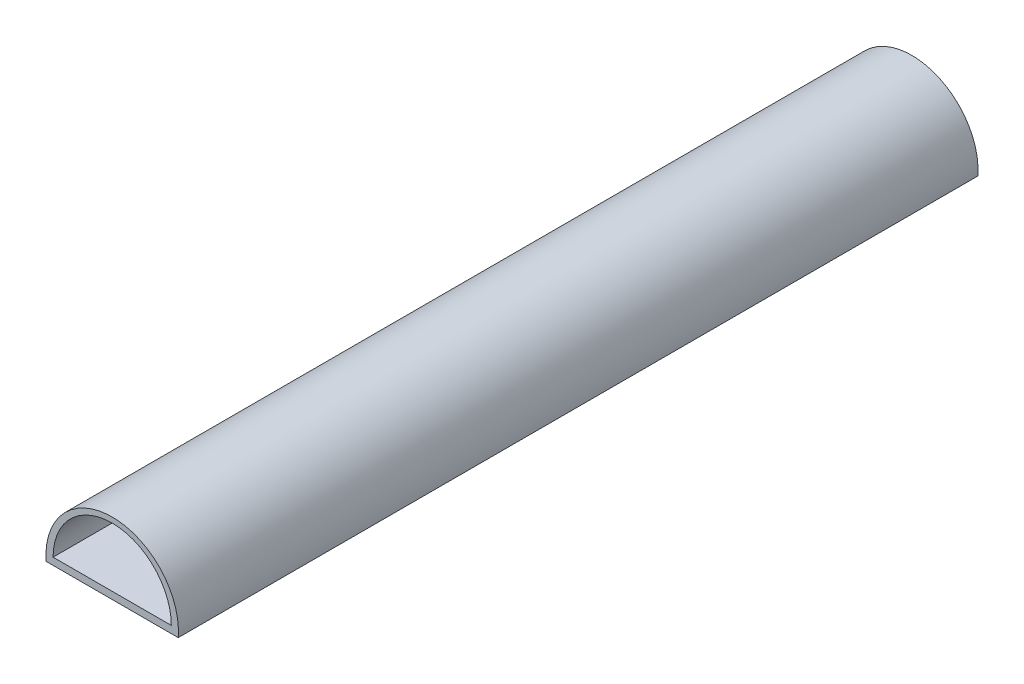
from build123d import *

# Parameters (mm, degrees)
BOSS_EXTRUDE2_DEPTH = 177.8


with BuildPart() as part:
    # Sketch1 → Boss-Extrude2 (new body)
    with BuildSketch(Plane.XY):
        with BuildLine():
            Line((-23.111377793, -10.048425127), (6.257372207, -10.048425127))
            ThreePointArc((6.257372207, -10.048425127), (-8.427002793, 5.85418124), (-23.111377793, -10.048425127))
        make_face()
        with BuildLine():
            Line((-8.427002793, -8.460925127), (-21.571502793, -8.460925127))
            ThreePointArc((-21.571502793, -8.460925127), (-8.427002793, 4.683574873), (4.717497207, -8.460925127))
            Line((4.717497207, -8.460925127), (-8.427002793, -8.460925127))
        make_face(mode=Mode.SUBTRACT)
    extrude(amount=BOSS_EXTRUDE2_DEPTH)


solid = part.part
